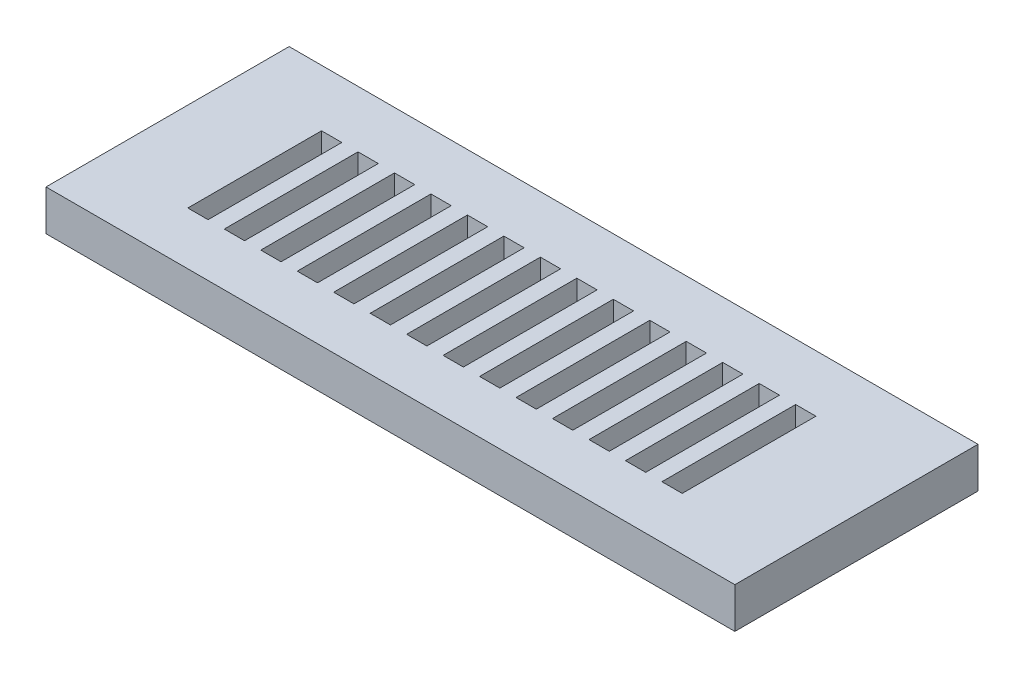
from build123d import *

# Parameters (mm, degrees)
SKETCH1_W           = 85
SKETCH1_H           = 30
BOSS_EXTRUDE1_DEPTH = 5
SKETCH2_W           = 2.5
SKETCH2_H           = 16.5
CUT_EXTRUDE1_DEPTH  = 5


with BuildPart() as part:
    # Sketch1 → Boss-Extrude1 (new body)
    with BuildSketch(Plane(origin=(0, 0, 0), x_dir=(1, 0, 0), z_dir=(0, 1, 0))):
        with Locations((42.5, 15)):
            Rectangle(SKETCH1_W, SKETCH1_H)
    extrude(amount=BOSS_EXTRUDE1_DEPTH)

    # Sketch2 → Cut-Extrude1 (cut)
    with BuildSketch(Plane(origin=(0, 5, 0), x_dir=(1, 0, 0), z_dir=(0, 1, 0))):
        with Locations((12.25, 14.75)):
            Rectangle(SKETCH2_W, SKETCH2_H)
        with Locations((16.75, 14.75)):
            Rectangle(SKETCH2_W, SKETCH2_H)
        with Locations((21.25, 14.75)):
            Rectangle(SKETCH2_W, SKETCH2_H)
        with Locations((25.75, 14.75)):
            Rectangle(SKETCH2_W, SKETCH2_H)
        with Locations((30.25, 14.75)):
            Rectangle(SKETCH2_W, SKETCH2_H)
        with Locations((34.75, 14.75)):
            Rectangle(SKETCH2_W, SKETCH2_H)
        with Locations((39.25, 14.75)):
            Rectangle(SKETCH2_W, SKETCH2_H)
        with Locations((43.75, 14.75)):
            Rectangle(SKETCH2_W, SKETCH2_H)
        with Locations((48.25, 14.75)):
            Rectangle(SKETCH2_W, SKETCH2_H)
        with Locations((52.75, 14.75)):
            Rectangle(SKETCH2_W, SKETCH2_H)
        with Locations((57.25, 14.75)):
            Rectangle(SKETCH2_W, SKETCH2_H)
        with Locations((61.75, 14.75)):
            Rectangle(SKETCH2_W, SKETCH2_H)
        with Locations((66.25, 14.75)):
            Rectangle(SKETCH2_W, SKETCH2_H)
        with Locations((70.75, 14.75)):
            Rectangle(SKETCH2_W, SKETCH2_H)
    extrude(amount=-CUT_EXTRUDE1_DEPTH, mode=Mode.SUBTRACT)


solid = part.part
